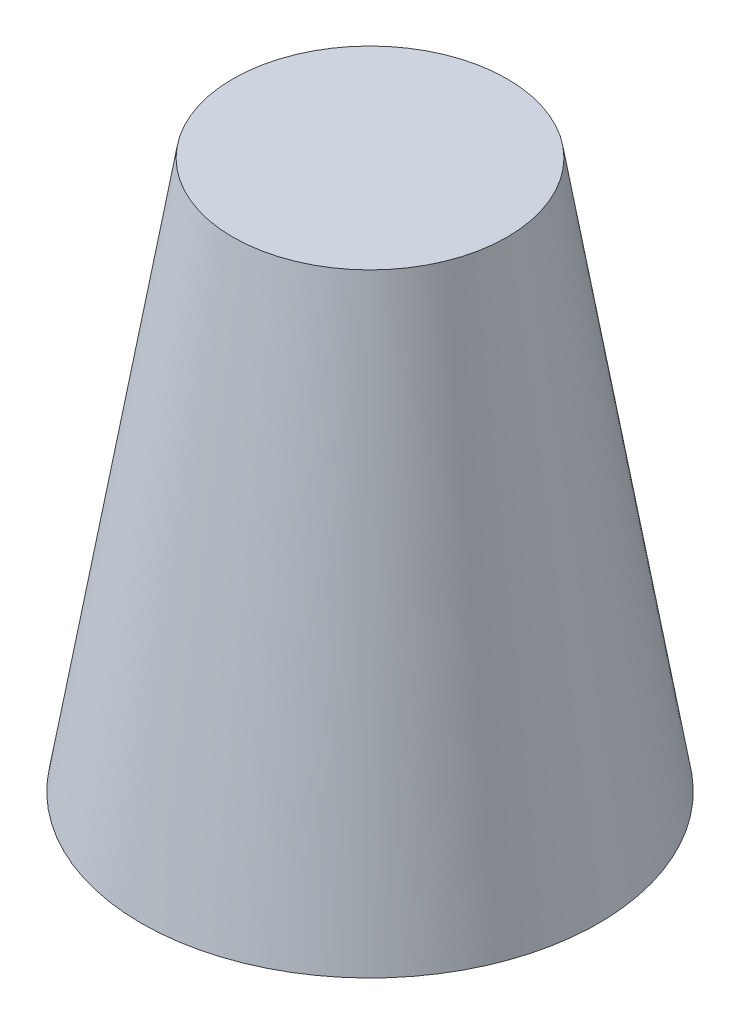
from build123d import *


with BuildPart() as part:
    # 草图1 → 旋转1 (revolve)
    with BuildSketch(Plane(origin=(0, 0, 0), x_dir=(0, 0, -1), z_dir=(1, 0, 0))):
        Polygon((0, 0), (25, 0), (15, 60), (0, 60), align=None)
    revolve(axis=Axis((0, 0, 0), (0, 1, 0)))


solid = part.part
